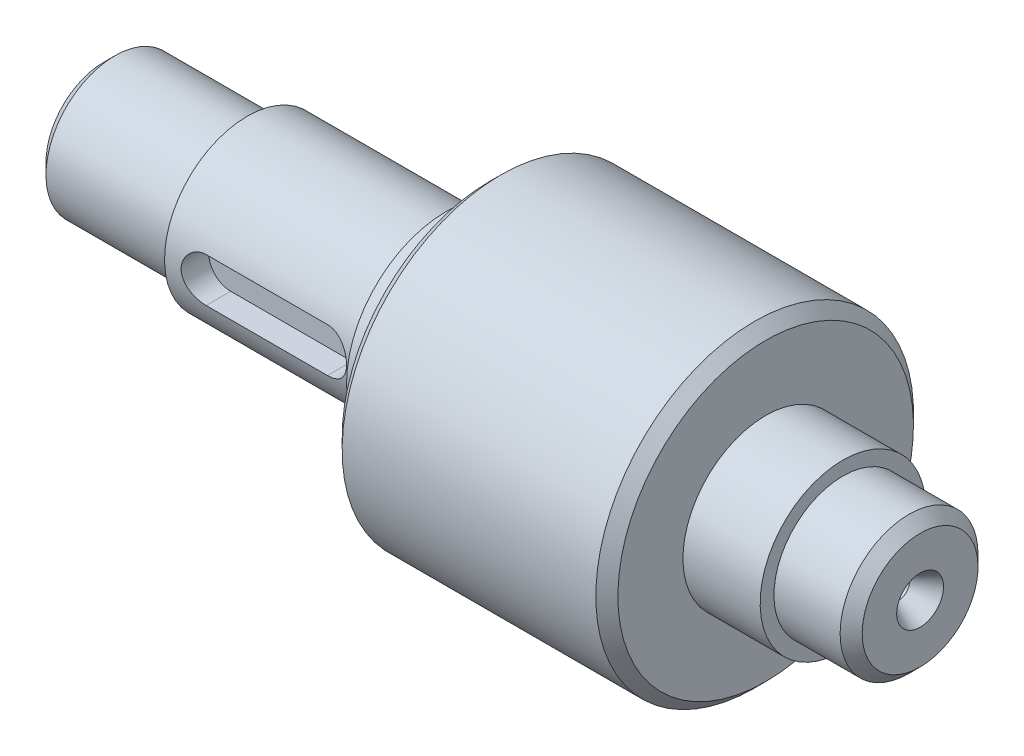
from build123d import *

# Parameters (mm, degrees)
CUT_EXTRUDE_START   = 10
CUT_EXTRUDE_2_DEPTH = 144.502052104
CHAMFER_1_SIZE      = 2
CHAMFER_2_SIZE      = 2


with BuildPart() as part:
    # Эскиз1 → Повернуть1 (revolve)
    with BuildSketch(Plane.XY, mode=Mode.PRIVATE) as revolve_1_sk:
        Polygon((0, 0), (0, -12.5), (26, -12.5), (26, -15), (62, -15), (62, -18), (70, -18), (70, -28.8), (120, -28.8), (120, -15), (134, -15), (134, -12.5), (148, -12.5), (148, 0), align=None)
    revolve(revolve_1_sk.sketch.rotate(Axis((148, 0, 0), (-1, 0, 0)), 180), axis=Axis((148, 0, 0), (-1, 0, 0)))

    # Эскиз3 → Вырез-Повернуть1 (revolve, cut)
    with BuildSketch(Plane.XY, mode=Mode.PRIVATE) as cut_revolve_1_sk:
        Polygon((0, 0), (10.054700538, 0), (8.9, 2), (3.9, 2), (0, 4.25), align=None)
    cut_revolve_1 = revolve(cut_revolve_1_sk.sketch.rotate(Axis((0, 0, 0), (1, 0, 0)), 90), axis=Axis((0, 0, 0), (1, 0, 0)), mode=Mode.SUBTRACT)

    # Зеркальное отражение1: Вырез-Повернуть1 across plane
    add(cut_revolve_1.mirror(Plane.ZY.offset(-74)), mode=Mode.SUBTRACT)

    # Эскиз4 → Вырез-Вытянуть2 (cut, through all)
    with BuildSketch(Plane.XY.offset(CUT_EXTRUDE_START)):
        with BuildLine():
            Line((33, 4), (55, 4))
            ThreePointArc((55, 4), (59, 0), (55, -4))
            Line((55, -4), (33, -4))
            ThreePointArc((33, -4), (29, 0), (33, 4))
        make_face()
    extrude(amount=CUT_EXTRUDE_2_DEPTH, mode=Mode.SUBTRACT)

    # Фаска1
    chamfer_1_edges = [part.edges().sort_by_distance(p)[0] for p in [
        (0, -12.5, 0),
    ]]
    chamfer(chamfer_1_edges, length=CHAMFER_1_SIZE)

    # Фаска2
    chamfer_2_edges = [part.edges().sort_by_distance(p)[0] for p in [
        (148, -12.5, 0),
        (120, -28.8, 0),
        (70, -28.8, 0),
    ]]
    chamfer(chamfer_2_edges, length=CHAMFER_2_SIZE)


solid = part.part
